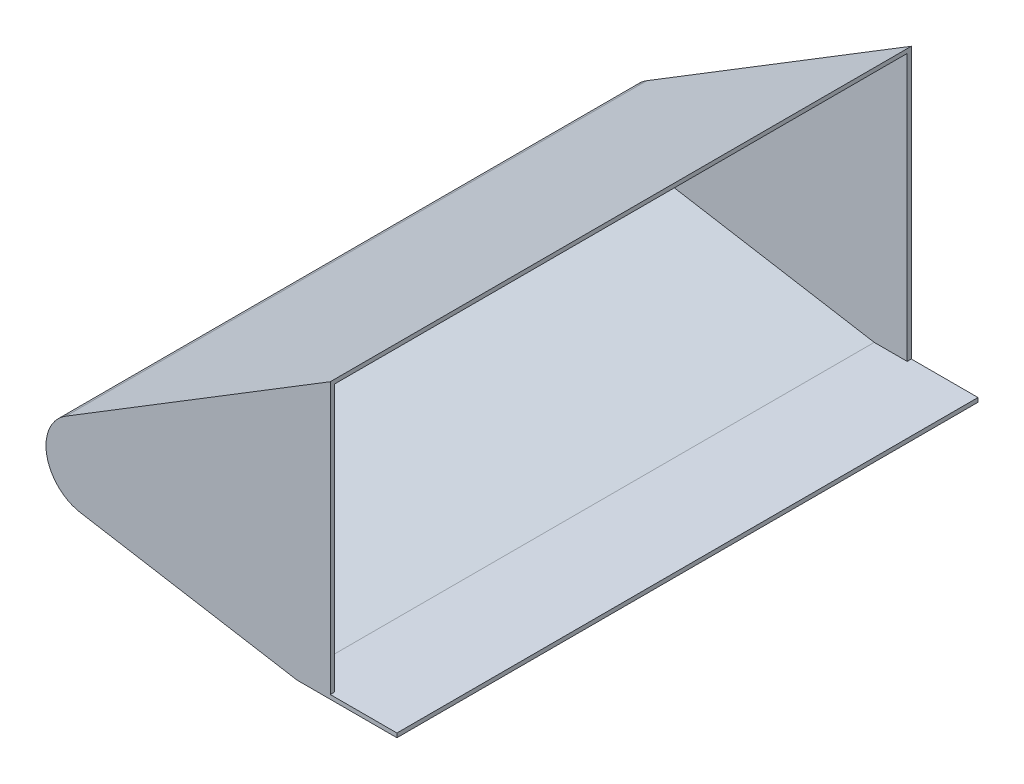
from build123d import *

# Parameters (mm, degrees)
BOSS_EXTRUDE1_DEPTH = 700
FILLET4_R           = 50
FILLET5_R           = 50
BOSS_EXTRUDE2_DEPTH = 5


with BuildPart() as part:
    # Sketch1 → Boss-Extrude1 (new body)
    with BuildSketch(Plane.XY):
        Polygon((0, 0), (-120, 0), (-500.276363355, 64.455479422), (-80.272969111, 321.336979592), (-80.272969111, 326.336979592), (-506.593051288, 65.087697234), (-512.515194277, 61.458603343), (-505.351292424, 60.244347678), (-120.420740562, -5), (0, -5), align=None)
    extrude(amount=BOSS_EXTRUDE1_DEPTH)

    # Fillet4
    fillet4_edges = [part.edges().sort_by_distance(p)[0] for p in [
        (-500.276363355, 64.455479422, 350),
    ]]
    fillet(fillet4_edges, radius=FILLET4_R)

    # Fillet5
    fillet5_edges = [part.edges().sort_by_distance(p)[0] for p in [
        (-512.515194277, 61.458603343, 350),
    ]]
    fillet(fillet5_edges, radius=FILLET5_R)

    # Sketch2 → Boss-Extrude2 (add)
    with BuildSketch(Plane.XY.offset(700)):
        with BuildLine():
            Line((-120.420740562, -5), (-381.084420098, 39.181558602))
            add(Edge.make_bspline(
                [(-398.853702629, 131.110455006), (-406.706116268, 126.337398714), (-417.396955451, 114.668240543), (-424.220724955, 91.713060572), (-421.112435822, 70.320363039), (-406.882601787, 49.048758298), (-391.360070335, 40.876151559), (-381.084420098, 39.181558602)],
                knots=[0, 0, 0, 0, 0.228119285, 0.378356265, 0.583675291, 0.742972739, 1, 1, 1, 1], degree=3))
            Line((-398.853702629, 131.110455006), (-80.272969111, 326.336979592))
            Line((-80.272969111, 326.336979592), (-80.272969111, 0))
            Line((-80.272969111, 0), (-80.272969111, -5))
            Line((-80.272969111, -5), (-120.420740562, -5))
        make_face()
    extrude(amount=-BOSS_EXTRUDE2_DEPTH)

    # Mirror2: part across plane


with BuildPart() as part_1:
    add(part.part)
    add(part.part.mirror(Plane.XY.offset(350)))


solid = part_1.part
